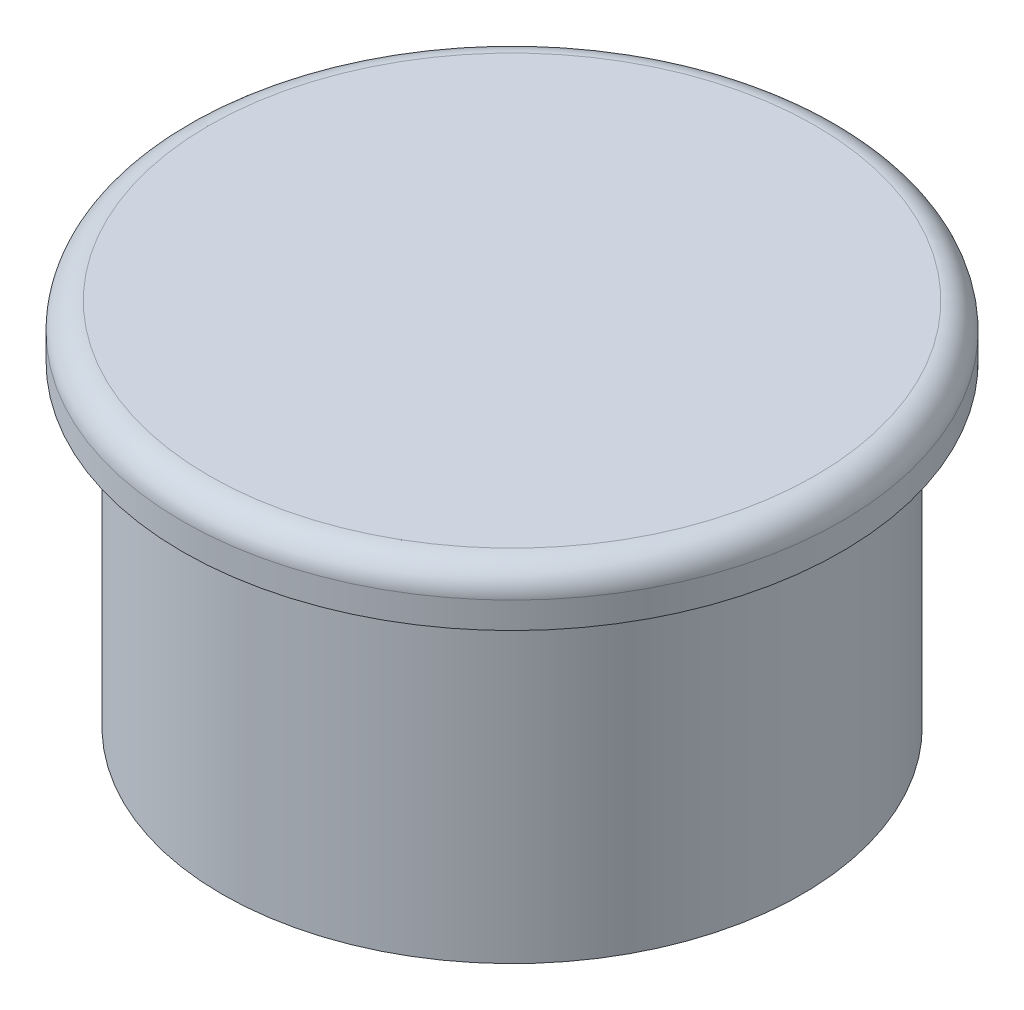
from build123d import *

# Parameters (mm, degrees)
SKETCH2_R           = 11
SKETCH2_R_2         = 9
BOSS_EXTRUDE1_DEPTH = 12
SKETCH3_R           = 12.5
BOSS_EXTRUDE2_DEPTH = 2
FILLET1_R           = 1


with BuildPart() as part:
    # Sketch2 → Boss-Extrude1 (new body)
    with BuildSketch(Plane(origin=(0, 0, 0), x_dir=(1, 0, 0), z_dir=(0, 1, 0))):
        with Locations(Location((0, 0, 0), (0, 0, 270))):
            Circle(SKETCH2_R)
        with Locations(Location((0, 0, 0), (0, 0, 270))):
            Circle(SKETCH2_R_2, mode=Mode.SUBTRACT)
    extrude(amount=BOSS_EXTRUDE1_DEPTH)

    # Sketch3 → Boss-Extrude2 (add)
    with BuildSketch(Plane(origin=(0, 12, 0), x_dir=(1, 0, 0), z_dir=(0, 1, 0))):
        with Locations(Location((0, 0, 0), (0, 0, 270))):
            Circle(SKETCH3_R)
    extrude(amount=BOSS_EXTRUDE2_DEPTH)

    # Fillet1
    fillet1_edges = [part.edges().sort_by_distance(p)[0] for p in [
        (0, 14, -12.5),
    ]]
    fillet(fillet1_edges, radius=FILLET1_R)


solid = part.part
